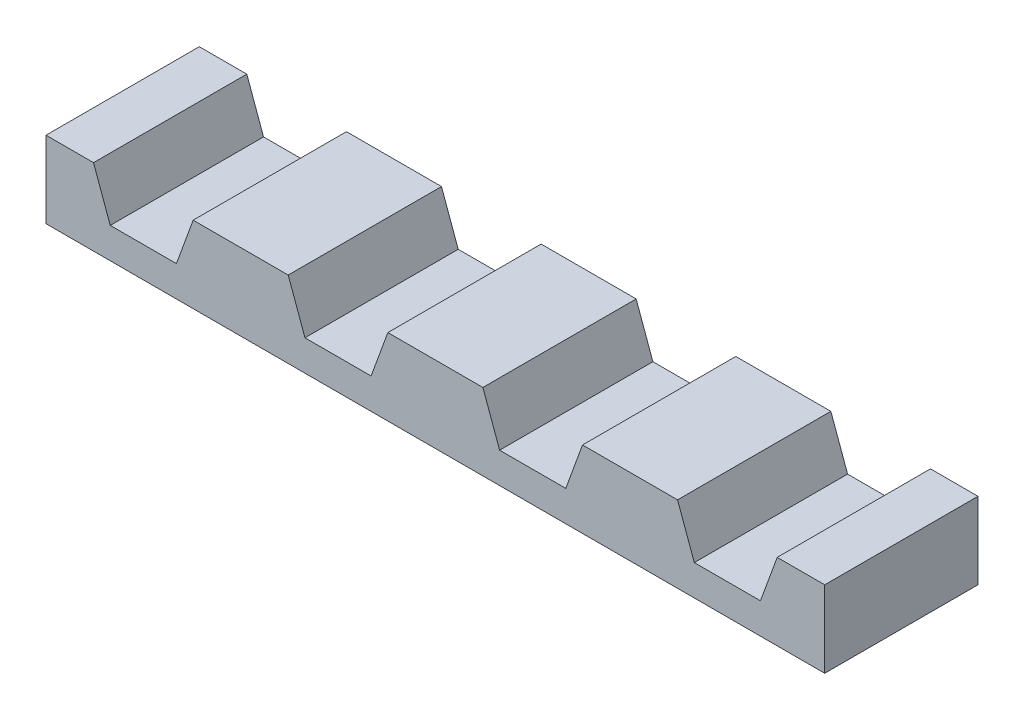
from build123d import *

# Parameters (mm, degrees)
SKETCH1_W           = 50.8
SKETCH1_H           = 5
BOSS_EXTRUDE1_DEPTH = 10
CUT_EXTRUDE2_DEPTH  = 53.01576684
LPATTERN1_COUNT     = 4
LPATTERN1_PITCH     = 12.7


with BuildPart() as part:
    # Sketch1 → Boss-Extrude1 (new body)
    with BuildSketch(Plane.XY):
        with Locations((25.4, 2.5)):
            Rectangle(SKETCH1_W, SKETCH1_H)
    extrude(amount=BOSS_EXTRUDE1_DEPTH)

    # Sketch3 → Cut-Extrude2 (cut, through all)
    with BuildSketch(Plane.XY.offset(10)):
        Polygon((2.008089297, 8), (4.191910703, 2), (8.508089297, 2), (10.691910703, 8), align=None)
    cut_extrude2 = extrude(amount=-CUT_EXTRUDE2_DEPTH, mode=Mode.SUBTRACT)

    # LPattern1: Cut-Extrude2 ×4
    with Locations(*[(i * LPATTERN1_PITCH, 0, 0) for i in range(1, LPATTERN1_COUNT)]):
        add(cut_extrude2, mode=Mode.SUBTRACT)


solid = part.part
